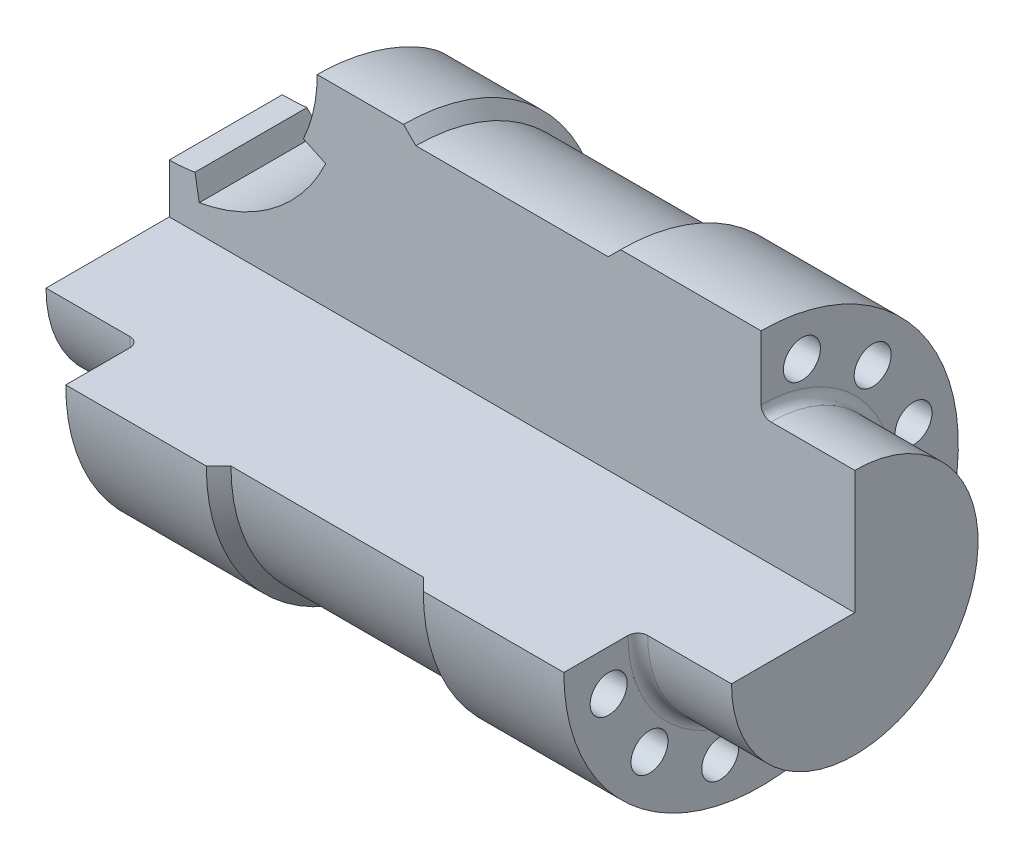
from build123d import *

# Parameters (mm, degrees)
SKETCH2_R          = 3.75
CUT_EXTRUDE1_DEPTH = 133.664991614
FILLET1_R          = 2
CUT_EXTRUDE2_DEPTH = 151.069983674
CUT_EXTRUDE3_DEPTH = 151.069983674


with BuildPart() as part:
    # Sketch1 → Revolve1 (revolve)
    with BuildSketch(Plane(origin=(0, 0, 0), x_dir=(1, 0, 0), z_dir=(0, 1, 0)), mode=Mode.PRIVATE) as revolve1_sk:
        Polygon((0, 0), (139, 0), (139, 25), (120, 25), (120, 40), (91.5, 40), (89, 37.5), (50, 37.5), (47.5, 40), (19, 40), (19, 25), (0, 25), align=None)
    revolve(revolve1_sk.sketch.rotate(Axis((0, 0, 0), (1, 0, 0)), 180), axis=Axis((0, 0, 0), (1, 0, 0)))

    # Sketch2 → Cut-Extrude1 (cut, through all)
    with BuildSketch(Plane(origin=(120, 0, 0), x_dir=(0, 0, -1), z_dir=(1, 0, 0))):
        with Locations((-8.282209443, 30.909626441)):
            Circle(SKETCH2_R)
        with Locations((8.282209443, 30.909626441)):
            Circle(SKETCH2_R)
        with Locations((22.627416998, 22.627416998)):
            Circle(SKETCH2_R)
        with Locations((30.909626441, 8.282209443)):
            Circle(SKETCH2_R)
        with Locations((30.909626441, -8.282209443)):
            Circle(SKETCH2_R)
        with Locations((22.627416998, -22.627416998)):
            Circle(SKETCH2_R)
        with Locations((8.282209443, -30.909626441)):
            Circle(SKETCH2_R)
        with Locations((-8.282209443, -30.909626441)):
            Circle(SKETCH2_R)
        with Locations((-22.627416998, -22.627416998)):
            Circle(SKETCH2_R)
        with Locations((-30.909626441, -8.282209443)):
            Circle(SKETCH2_R)
        with Locations((-30.909626441, 8.282209443)):
            Circle(SKETCH2_R)
        with Locations((-22.627416998, 22.627416998)):
            Circle(SKETCH2_R)
    extrude(amount=-CUT_EXTRUDE1_DEPTH, mode=Mode.SUBTRACT)

    # Fillet1
    fillet1_edges = [part.edges().sort_by_distance(p)[0] for p in [
        (120, 0, -25),
        (19, 0, -25),
    ]]
    fillet(fillet1_edges, radius=FILLET1_R)

    # Sketch3 → Cut-Extrude2 (cut, through all)
    with BuildSketch(Plane.ZY):
        with BuildLine():
            Line((0, 0), (0, 40))
            ThreePointArc((0, 40), (28.284271247, 28.284271247), (40, 0))
            Line((40, 0), (0, 0))
        make_face()
    extrude(amount=-CUT_EXTRUDE2_DEPTH, mode=Mode.SUBTRACT)

    # Sketch5 → Cut-Extrude3 (cut, through all)
    with BuildSketch(Plane.XY):
        with BuildLine():
            Line((2.644904711, 25), (5.20944533, 10.45576741))
            Line((5.20944533, 10.45576741), (6.077686218, 5.531728645))
            ThreePointArc((6.077686218, 5.531728645), (21.306650015, 12.23263309), (31.720772546, 25.208360839))
            Line((31.720772546, 25.208360839), (27.189233611, 27.321452148))
            Line((27.189233611, 27.321452148), (19, 31.140154495))
            Line((19, 31.140154495), (19, 27))
            ThreePointArc((19, 27), (18.414213562, 25.585786438), (17, 25))
            Line((17, 25), (2.644904711, 25))
        make_face()
        with BuildLine():
            Line((30, 40), (19, 40))
            Line((19, 40), (19, 31.140154495))
            Line((19, 31.140154495), (27.189233611, 27.321452148))
            ThreePointArc((27.189233611, 27.321452148), (29.288880214, 33.506811582), (30, 40))
        make_face()
        with BuildLine():
            Line((0, 25), (0, 10))
            ThreePointArc((0, 10), (2.614672282, 10.114159057), (5.20944533, 10.45576741))
            Line((5.20944533, 10.45576741), (2.644904711, 25))
            Line((2.644904711, 25), (0, 25))
        make_face()
    extrude(amount=-CUT_EXTRUDE3_DEPTH, mode=Mode.SUBTRACT)


solid = part.part
